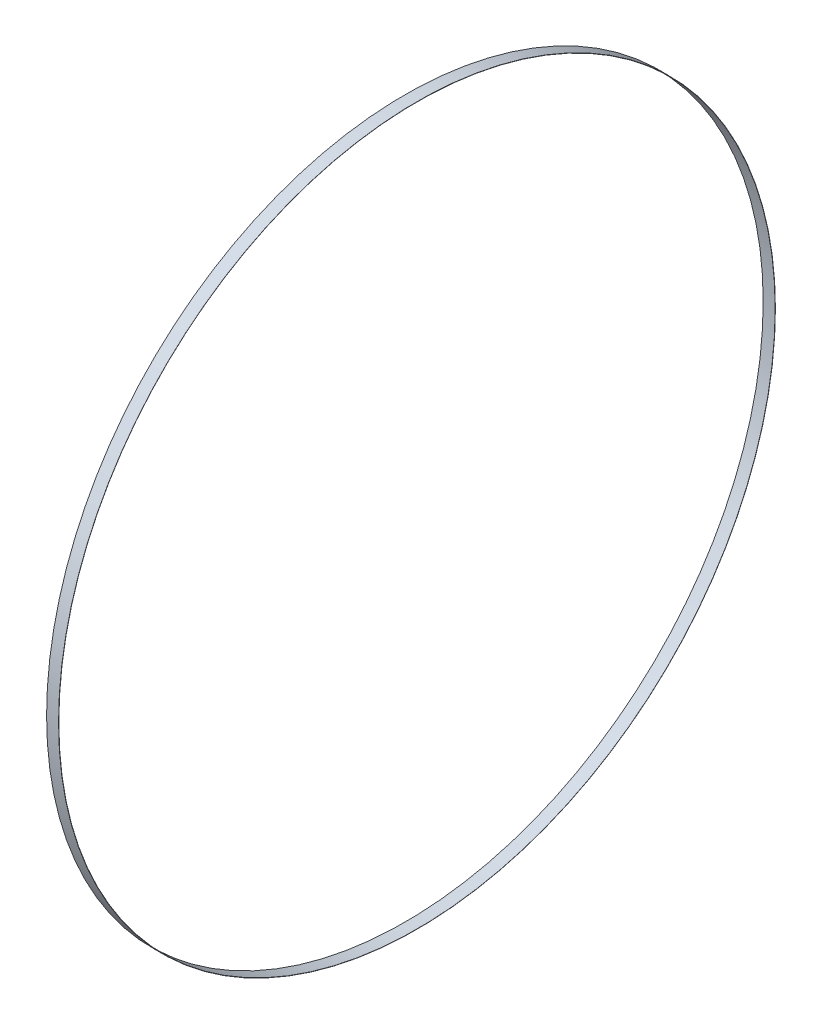
from build123d import *

# Parameters (mm, degrees)
SKETCH_1_W = 50
SKETCH_1_H = 1


with BuildPart() as part:
    # Эскиз1 → Повернуть1 (revolve)
    with BuildSketch(Plane.XY, mode=Mode.PRIVATE) as revolve_1_sk:
        with Locations((25, -1495)):
            Rectangle(SKETCH_1_W, SKETCH_1_H)
    revolve(revolve_1_sk.sketch.rotate(Axis((0, 0, 0), (1, 0, 0)), 270), axis=Axis((0, 0, 0), (1, 0, 0)))


solid = part.part
